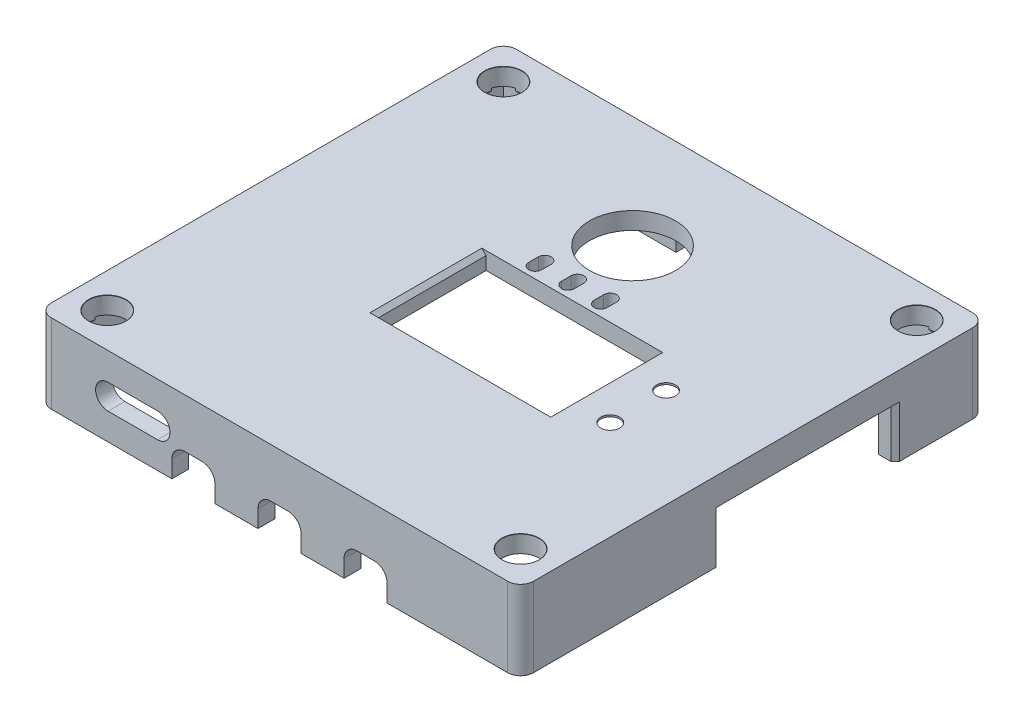
from build123d import *

# Parameters (mm, degrees)
SKETCH_1_W                  = 56
SKETCH_1_H                  = 54
SKETCH_1_R                  = 5
EXTRUDE_1_DEPTH             = 9.2
HOLE_WIZARD_M2_1_AT_2_COUNT = 2
HOLE_WIZARD_M2_1_AT_2_PITCH = 48
HOLE_WIZARD_M2_1_AT_3_COUNT = 2
HOLE_WIZARD_M2_1_AT_3_PITCH = 46
HOLE_WIZARD_M2_1_AT_4_COUNT = 2
HOLE_WIZARD_M2_1_AT_4_PITCH = 66.483080554
SKETCH_13_W                 = 52.1
SKETCH_13_H                 = 50.1
CUT_EXTRUDE_1_DEPTH         = 40.558058597
SKETCH_14_W                 = 20
SKETCH_14_H                 = 13
CUT_EXTRUDE_2_DEPTH         = 40.970489114
SKETCH_15_R                 = 1.1
CUT_EXTRUDE_4_DEPTH         = 40.970489114
CUT_EXTRUDE_7_REACH         = 63.519
SKETCH_18_W                 = 5
SKETCH_18_H                 = 5
CUT_EXTRUDE_8_REACH         = 64.846
SKETCH_20_W                 = 17.8
SKETCH_20_H                 = 6
CUT_EXTRUDE_9_REACH         = 64.846
SKETCH_23_W                 = 20.32
SKETCH_23_H                 = 6
CHAMFER_1_SIZE              = 0.5
CUT_EXTRUDE_10_REACH        = 63.519
FILLET_4_R                  = 1.5
CHAMFER_2_SIZE              = 0.5
CHAMFER_3_SIZE              = 0.5
CUT_EXTRUDE_11_REACH        = 63.519
SKETCH_25_W                 = 5
SKETCH_25_H                 = 3.5
FILLET_5_R                  = 1.5
CUT_EXTRUDE_12_REACH        = 63.519
SKETCH_30_W                 = 6.5
SKETCH_30_H                 = 4.8
SKETCH_30_W_2               = 8
SKETCH_30_H_2               = 6
CUT_EXTRUDE_13_REACH        = 41.97
CHAMFER_4_SIZE              = 0.5
SKETCH_35_W                 = 7.974588705
SKETCH_35_H                 = 13
SKETCH_35_W_2               = 9
SKETCH_35_H_2               = 10.5
SKETCH_35_W_3               = 11
SKETCH_35_H_3               = 6.8
SKETCH_35_W_4               = 3.5
SKETCH_35_H_4               = 1.5
CUT_EXTRUDE_14_DEPTH        = 1.8
FILLET_6_R                  = 1.5


with BuildPart() as part:
    # 草图1 → 凸台-拉伸1 (new body)
    with BuildSketch(Plane(origin=(0, 0, 0), x_dir=(1, 0, 0), z_dir=(0, 1, 0))):
        Rectangle(SKETCH_1_W, SKETCH_1_H)
        with Locations(Location((0, 14, 0), (0, 0, 270))):
            Circle(SKETCH_1_R, mode=Mode.SUBTRACT)
    extrude(amount=EXTRUDE_1_DEPTH)

    # 草图6 → M2 六角圆柱头螺钉的柱形沉头孔1 (revolve, cut)
    with BuildSketch(Plane(origin=(-24, 9.2, -23), x_dir=(0, 0, 1), z_dir=(1, 0, 0))):
        Polygon((0, 0), (0, 9.2), (1.3, 9.2), (1.3, 2.3), (2.15, 2.3), (2.15, 0.025), (2.175, 0), align=None)
    hole_wizard_m2_1 = revolve(axis=Axis((-24, 15.55, -23), (0, -1, 0)), mode=Mode.SUBTRACT)

    # M2 六角圆柱头螺钉的柱形沉头孔1 at 2: M2 六角圆柱头螺钉的柱形沉头孔1 ×2
    with Locations(*[(i * HOLE_WIZARD_M2_1_AT_2_PITCH, 0, 0) for i in range(1, HOLE_WIZARD_M2_1_AT_2_COUNT)]):
        add(hole_wizard_m2_1, mode=Mode.SUBTRACT)

    # M2 六角圆柱头螺钉的柱形沉头孔1 at 3: M2 六角圆柱头螺钉的柱形沉头孔1 ×2
    with Locations(*[(0, 0, i * HOLE_WIZARD_M2_1_AT_3_PITCH) for i in range(1, HOLE_WIZARD_M2_1_AT_3_COUNT)]):
        add(hole_wizard_m2_1, mode=Mode.SUBTRACT)

    # M2 六角圆柱头螺钉的柱形沉头孔1 at 4: M2 六角圆柱头螺钉的柱形沉头孔1 ×2
    with Locations(*[Vector(0.7219882051154243, 0, 0.6919053632356149) * (i * HOLE_WIZARD_M2_1_AT_4_PITCH) for i in range(1, HOLE_WIZARD_M2_1_AT_4_COUNT)]):
        add(hole_wizard_m2_1, mode=Mode.SUBTRACT)

    # 草图13 → 切除-拉伸1 (cut, through all)
    with BuildSketch(Plane(origin=(0, 7.2, 0), x_dir=(1, 0, 0), z_dir=(0, 1, 0))):
        Rectangle(SKETCH_13_W, SKETCH_13_H)
    extrude(amount=-CUT_EXTRUDE_1_DEPTH, mode=Mode.SUBTRACT)

    # 草图14 → 切除-拉伸2 (cut, through all)
    with BuildSketch(Plane(origin=(0, 9.2, 0), x_dir=(1, 0, 0), z_dir=(0, 1, 0))):
        with Locations((2, -1.5)):
            Rectangle(SKETCH_14_W, SKETCH_14_H)
    extrude(amount=-CUT_EXTRUDE_2_DEPTH, mode=Mode.SUBTRACT)

    # 草图15 → 切除-拉伸4 (cut, through all)
    with BuildSketch(Plane(origin=(0, 9.2, 0), x_dir=(1, 0, 0), z_dir=(0, 1, 0))):
        with Locations(Location((16.5, 1.39, 0), (0, 0, 270))):
            Circle(SKETCH_15_R)
        with Locations(Location((16.5, -5.09, 0), (0, 0, 270))):
            Circle(SKETCH_15_R)
    extrude(amount=-CUT_EXTRUDE_4_DEPTH, mode=Mode.SUBTRACT)

    # 草图18 → 切除-拉伸7 (cut, up to next)
    with BuildSketch(Plane(origin=(0, 0, -27), x_dir=(-1, 0, 0), z_dir=(0, 0, -1)), mode=Mode.PRIVATE) as cut_extrude_7_sk1:
        with Locations((-3.5, 2.5)):
            Rectangle(SKETCH_18_W, SKETCH_18_H)
    cut_extrude_7_tool1 = extrude(cut_extrude_7_sk1.sketch, amount=-CUT_EXTRUDE_7_REACH, mode=Mode.PRIVATE) & part.part
    # 草图18 → 切除-拉伸7 (cut, up to next)
    with BuildSketch(Plane(origin=(0, 0, -27), x_dir=(-1, 0, 0), z_dir=(0, 0, -1)), mode=Mode.PRIVATE) as cut_extrude_7_sk2:
        with Locations((3.5, 2.5)):
            Rectangle(SKETCH_18_W, SKETCH_18_H)
    cut_extrude_7_tool2 = extrude(cut_extrude_7_sk2.sketch, amount=-CUT_EXTRUDE_7_REACH, mode=Mode.PRIVATE) & part.part
    add(cut_extrude_7_tool1.solids().sort_by_distance((3.5, 2.5, -27))[0], mode=Mode.SUBTRACT)
    add(cut_extrude_7_tool2.solids().sort_by_distance((-3.5, 2.5, -27))[0], mode=Mode.SUBTRACT)

    # 草图20 → 切除-拉伸8 (cut, up to next)
    with BuildSketch(Plane.ZY.offset(28), mode=Mode.PRIVATE) as cut_extrude_8_sk1:
        with Locations((-5.1, 3)):
            Rectangle(SKETCH_20_W, SKETCH_20_H)
    cut_extrude_8_tool1 = extrude(cut_extrude_8_sk1.sketch, amount=-CUT_EXTRUDE_8_REACH, mode=Mode.PRIVATE) & part.part
    add(cut_extrude_8_tool1.solids().sort_by_distance((-28, 3, -5.1))[0], mode=Mode.SUBTRACT)

    # 草图23 → 切除-拉伸9 (cut, up to next)
    with BuildSketch(Plane(origin=(28, 0, 0), x_dir=(0, 0, -1), z_dir=(1, 0, 0)), mode=Mode.PRIVATE) as cut_extrude_9_sk1:
        with Locations((6.33, 3)):
            Rectangle(SKETCH_23_W, SKETCH_23_H)
    cut_extrude_9_tool1 = extrude(cut_extrude_9_sk1.sketch, amount=-CUT_EXTRUDE_9_REACH, mode=Mode.PRIVATE) & part.part
    add(cut_extrude_9_tool1.solids().sort_by_distance((28, 3, -6.33))[0], mode=Mode.SUBTRACT)

    # 倒角1
    chamfer_1_edges = [part.edges().sort_by_distance(p)[0] for p in [
        (-8, 9.2, 1.5),
        (12, 9.2, 1.5),
    ]]
    chamfer(chamfer_1_edges, length=CHAMFER_1_SIZE)

    # 草图24 → 切除-拉伸10 (cut, up to next)
    with BuildSketch(Plane.XY.offset(27), mode=Mode.PRIVATE) as cut_extrude_10_sk1:
        with BuildLine():
            Line((-19.91, 6), (-14.17, 6))
            ThreePointArc((-14.17, 6), (-12.72, 4.55), (-14.17, 3.1))
            Line((-14.17, 3.1), (-19.91, 3.1))
            ThreePointArc((-19.91, 3.1), (-21.36, 4.55), (-19.91, 6))
        make_face()
    cut_extrude_10_tool1 = extrude(cut_extrude_10_sk1.sketch, amount=-CUT_EXTRUDE_10_REACH, mode=Mode.PRIVATE) & part.part
    add(cut_extrude_10_tool1.solids().sort_by_distance((-17.04, 4.55, 27))[0], mode=Mode.SUBTRACT)

    # 圆角4
    fillet_4_edges = [part.edges().sort_by_distance(p)[0] for p in [
        (1, 5, -26.025),
        (6, 5, -26.025),
        (-6, 5, -26.025),
        (-1, 5, -26.025),
    ]]
    fillet(fillet_4_edges, radius=FILLET_4_R)

    # 倒角2
    chamfer_2_edges = [part.edges().sort_by_distance(p)[0] for p in [
        (28, 3, 3.83),
        (28, 3, -16.49),
    ]]
    chamfer(chamfer_2_edges, length=CHAMFER_2_SIZE)

    # 倒角3
    chamfer_3_edges = [part.edges().sort_by_distance(p)[0] for p in [
        (-28, 3, 3.8),
        (-28, 3, -14),
    ]]
    chamfer(chamfer_3_edges, length=CHAMFER_3_SIZE)

    # 草图25 → 切除-拉伸11 (cut, up to next)
    with BuildSketch(Plane.XY.offset(27), mode=Mode.PRIVATE) as cut_extrude_11_sk1:
        with Locations((-10, 1.75)):
            Rectangle(SKETCH_25_W, SKETCH_25_H)
    cut_extrude_11_tool1 = extrude(cut_extrude_11_sk1.sketch, amount=-CUT_EXTRUDE_11_REACH, mode=Mode.PRIVATE) & part.part
    # 草图25 → 切除-拉伸11 (cut, up to next)
    with BuildSketch(Plane.XY.offset(27), mode=Mode.PRIVATE) as cut_extrude_11_sk2:
        with Locations((10, 1.75)):
            Rectangle(SKETCH_25_W, SKETCH_25_H)
    cut_extrude_11_tool2 = extrude(cut_extrude_11_sk2.sketch, amount=-CUT_EXTRUDE_11_REACH, mode=Mode.PRIVATE) & part.part
    # 草图25 → 切除-拉伸11 (cut, up to next)
    with BuildSketch(Plane.XY.offset(27), mode=Mode.PRIVATE) as cut_extrude_11_sk3:
        with Locations((0, 1.75)):
            Rectangle(SKETCH_25_W, SKETCH_25_H)
    cut_extrude_11_tool3 = extrude(cut_extrude_11_sk3.sketch, amount=-CUT_EXTRUDE_11_REACH, mode=Mode.PRIVATE) & part.part
    add(cut_extrude_11_tool1.solids().sort_by_distance((-10, 1.75, 27))[0], mode=Mode.SUBTRACT)
    add(cut_extrude_11_tool2.solids().sort_by_distance((10, 1.75, 27))[0], mode=Mode.SUBTRACT)
    add(cut_extrude_11_tool3.solids().sort_by_distance((0, 1.75, 27))[0], mode=Mode.SUBTRACT)

    # 圆角5
    fillet_5_edges = [part.edges().sort_by_distance(p)[0] for p in [
        (-12.5, 3.5, 26.025),
        (-7.5, 3.5, 26.025),
        (12.5, 3.5, 26.025),
        (7.5, 3.5, 26.025),
        (-2.5, 3.5, 26.025),
        (2.5, 3.5, 26.025),
    ]]
    fillet(fillet_5_edges, radius=FILLET_5_R)

    # 草图30 → 切除-拉伸12 (cut, up to next)
    with BuildSketch(Plane(origin=(0, 0, -27), x_dir=(-1, 0, 0), z_dir=(0, 0, -1)), mode=Mode.PRIVATE) as cut_extrude_12_sk1:
        with Locations((-14, 3.6)):
            Rectangle(SKETCH_30_W, SKETCH_30_H)
    cut_extrude_12_tool1 = extrude(cut_extrude_12_sk1.sketch, amount=-CUT_EXTRUDE_12_REACH, mode=Mode.PRIVATE) & part.part
    # 草图30 → 切除-拉伸12 (cut, up to next)
    with BuildSketch(Plane(origin=(0, 0, -27), x_dir=(-1, 0, 0), z_dir=(0, 0, -1)), mode=Mode.PRIVATE) as cut_extrude_12_sk2:
        with Locations((16.3, 3)):
            Rectangle(SKETCH_30_W_2, SKETCH_30_H_2)
    cut_extrude_12_tool2 = extrude(cut_extrude_12_sk2.sketch, amount=-CUT_EXTRUDE_12_REACH, mode=Mode.PRIVATE) & part.part
    add(cut_extrude_12_tool1.solids().sort_by_distance((14, 3.6, -27))[0], mode=Mode.SUBTRACT)
    add(cut_extrude_12_tool2.solids().sort_by_distance((-16.3, 3, -27))[0], mode=Mode.SUBTRACT)

    # 草图33 → 切除-拉伸13 (cut, up to next)
    with BuildSketch(Plane(origin=(0, 9.2, 0), x_dir=(1, 0, 0), z_dir=(0, 1, 0)), mode=Mode.PRIVATE) as cut_extrude_13_sk1:
        with BuildLine():
            Line((-2.85, 7.4), (-2.85, 6.3))
            ThreePointArc((-2.85, 6.3), (-3.6, 5.55), (-4.35, 6.3))
            Line((-4.35, 6.3), (-4.35, 7.4))
            ThreePointArc((-4.35, 7.4), (-3.6, 8.15), (-2.85, 7.4))
        make_face()
    cut_extrude_13_tool1 = extrude(cut_extrude_13_sk1.sketch, amount=-CUT_EXTRUDE_13_REACH, mode=Mode.PRIVATE) & part.part
    # 草图33 → 切除-拉伸13 (cut, up to next)
    with BuildSketch(Plane(origin=(0, 9.2, 0), x_dir=(1, 0, 0), z_dir=(0, 1, 0)), mode=Mode.PRIVATE) as cut_extrude_13_sk2:
        with BuildLine():
            Line((0.95, 7.4), (0.95, 6.3))
            ThreePointArc((0.95, 6.3), (0.2, 5.55), (-0.55, 6.3))
            Line((-0.55, 6.3), (-0.55, 7.4))
            ThreePointArc((-0.55, 7.4), (0.2, 8.15), (0.95, 7.4))
        make_face()
    cut_extrude_13_tool2 = extrude(cut_extrude_13_sk2.sketch, amount=-CUT_EXTRUDE_13_REACH, mode=Mode.PRIVATE) & part.part
    # 草图33 → 切除-拉伸13 (cut, up to next)
    with BuildSketch(Plane(origin=(0, 9.2, 0), x_dir=(1, 0, 0), z_dir=(0, 1, 0)), mode=Mode.PRIVATE) as cut_extrude_13_sk3:
        with BuildLine():
            Line((4.75, 7.4), (4.75, 6.3))
            ThreePointArc((4.75, 6.3), (4, 5.55), (3.25, 6.3))
            Line((3.25, 6.3), (3.25, 7.4))
            ThreePointArc((3.25, 7.4), (4, 8.15), (4.75, 7.4))
        make_face()
    cut_extrude_13_tool3 = extrude(cut_extrude_13_sk3.sketch, amount=-CUT_EXTRUDE_13_REACH, mode=Mode.PRIVATE) & part.part
    add(cut_extrude_13_tool1.solids().sort_by_distance((-3.6, 9.2, -6.85))[0], mode=Mode.SUBTRACT)
    add(cut_extrude_13_tool2.solids().sort_by_distance((0.2, 9.2, -6.85))[0], mode=Mode.SUBTRACT)
    add(cut_extrude_13_tool3.solids().sort_by_distance((4, 9.2, -6.85))[0], mode=Mode.SUBTRACT)

    # 倒角4
    chamfer_4_edges = [part.edges().sort_by_distance(p)[0] for p in [
        (-12.3, 3, -27),
        (-20.3, 3, -27),
    ]]
    chamfer(chamfer_4_edges, length=CHAMFER_4_SIZE)

    # 草图35 → 切除-拉伸14 (cut)
    with BuildSketch(Plane.XZ.offset(-7.2)):
        with Locations((16.631295972, 1.5)):
            Rectangle(SKETCH_35_W, SKETCH_35_H)
        with Locations((-5.5, 13.25)):
            Rectangle(SKETCH_35_W_2, SKETCH_35_H_2)
        with Locations((-16.7, 20.4)):
            Rectangle(SKETCH_35_W_3, SKETCH_35_H_3)
        with Locations((-16.3, -15.3)):
            Rectangle(SKETCH_35_W_4, SKETCH_35_H_4)
    extrude(amount=-CUT_EXTRUDE_14_DEPTH, mode=Mode.SUBTRACT)

    # 圆角6
    fillet_6_edges = [part.edges().sort_by_distance(p)[0] for p in [
        (28, 4.6, 27),
        (-28, 4.6, 27),
        (-28, 4.6, -27),
        (28, 4.6, -27),
    ]]
    fillet(fillet_6_edges, radius=FILLET_6_R)


solid = part.part
